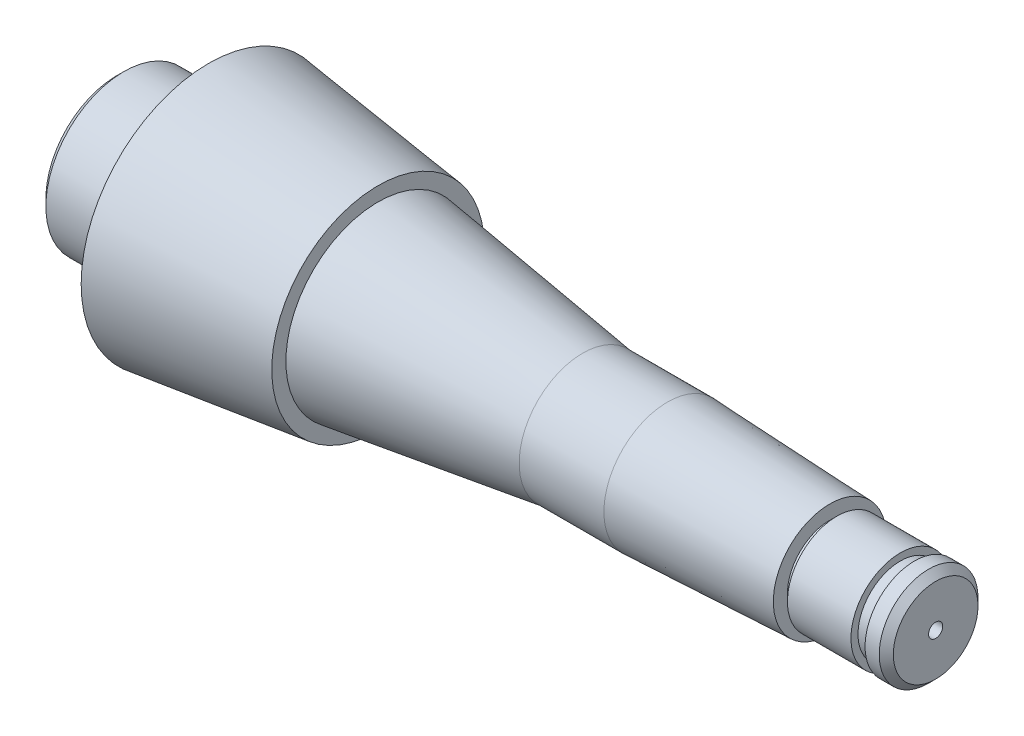
from build123d import *


with BuildPart() as part:
    # Esquisse1 → Révolution1 (revolve)
    with BuildSketch(Plane.XY, mode=Mode.PRIVATE) as r_volution1_sk:
        Polygon((116, 6), (115, 7), (113, 7), (113, 6), (111, 6), (111, 7), (102, 7), (102, 6), (101, 6), (101, 8), (78, 9), (66, 9), (37, 13.055520556), (37, 15.055520556), (13, 18.055520556), (13, 11.055520556), (1, 11.055520556), (0, 10.055520556), (0, 8.055520556), (23, 4), (33, 4), (36, 1), (65, 1), (66, 0.5), (78.5, 0.5), (78.5, 0.75), (79, 0.75), (79, 1), (116, 1), align=None)
    revolve(r_volution1_sk.sketch.rotate(Axis((15.989172968, 0, 0), (-1, 0, 0)), 90), axis=Axis((15.989172968, 0, 0), (-1, 0, 0)))


solid = part.part
